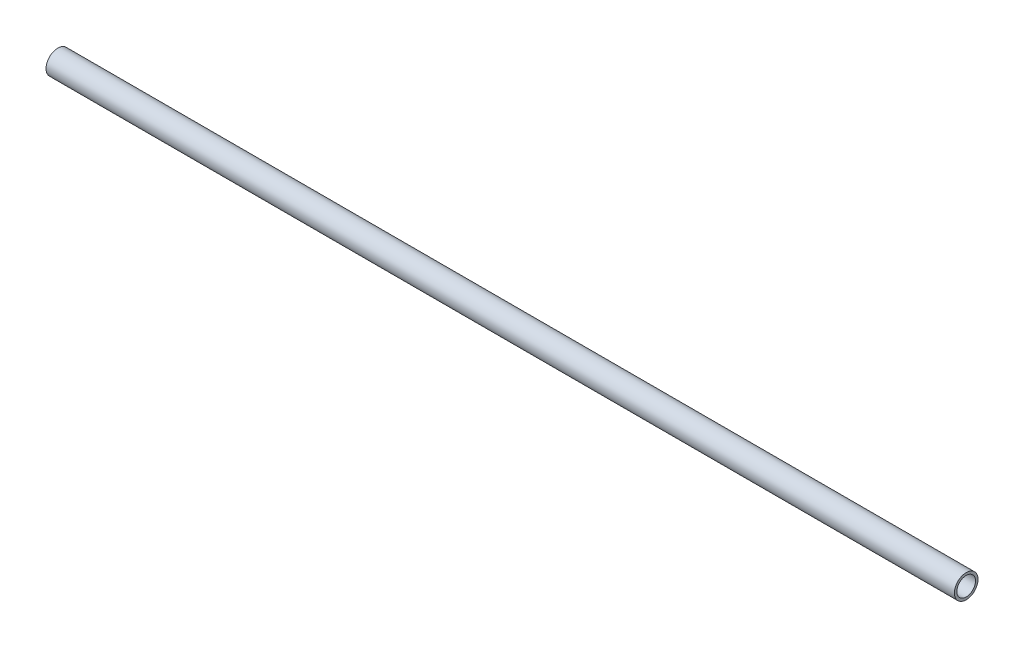
from build123d import *

# Parameters (mm, degrees)
CROQUIS1_R              = 19
CROQUIS1_R_2            = 15
SALIENTE_EXTRUIR1_DEPTH = 1460


with BuildPart() as part:
    # Croquis1 → Saliente-Extruir1 (new body)
    with BuildSketch(Plane(origin=(0, 0, 0), x_dir=(0, 0, -1), z_dir=(1, 0, 0))):
        with Locations(Location((0, 0, 0), (0, 0, 180))):
            Circle(CROQUIS1_R)
        with Locations(Location((0, 0, 0), (0, 0, 180))):
            Circle(CROQUIS1_R_2, mode=Mode.SUBTRACT)
    extrude(amount=SALIENTE_EXTRUIR1_DEPTH)


solid = part.part
